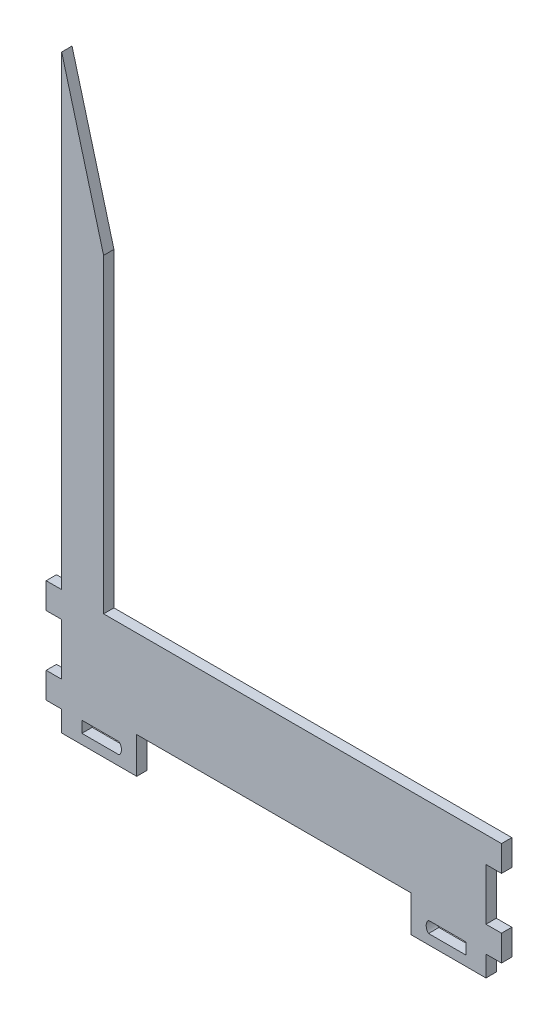
from build123d import *

# Parameters (mm, degrees)
EXTRUDE_1_DEPTH = 2


with BuildPart() as part:
    # 草图3 → 凸台-拉伸1 (new body)
    with BuildSketch(Plane.XY):
        Polygon((41, 20.009783315), (-32.9, 20.009783315), (-32.9, 80.009783315), (-41, 110.001113679), (-41, 60.009783315), (-41, 20.009783315), (-44, 20.009783315), (-44, 15.009783315), (-41, 15.009783315), (-41, 10.009783315), (-41, 7.009783315), (-41, 5.009783315), (-44, 5.009783315), (-44, 0.009783315), (-41, 0.009783315), (-41, -3.990216685), (-26.5, -3.990216685), (-26.5, 3.009783315), (26.5, 3.009783315), (26.5, -3.990216685), (41, -3.990216685), (41, 0.009783315), (44, 0.009783315), (44, 5.009783315), (41, 5.009783315), (41, 7.009783315), (41, 10.009783315), (41, 15.009783315), (44, 15.009783315), (44, 20.009783315), align=None)
        with BuildLine():
            Line((-37.1, -2.090216685), (-29.9, -2.090216685))
            ThreePointArc((-29.9, -2.090216685), (-29.444365081, -0.990216685), (-29.9, 0.109783315))
            Line((-29.9, 0.109783315), (-37.1, 0.109783315))
            Line((-37.1, 0.109783315), (-37.1, -2.090216685))
        make_face(mode=Mode.SUBTRACT)
        with BuildLine():
            Line((37.1, -2.090216685), (29.9, -2.090216685))
            ThreePointArc((29.9, -2.090216685), (29.444365081, -0.990216685), (29.9, 0.109783315))
            Line((29.9, 0.109783315), (37.1, 0.109783315))
            Line((37.1, 0.109783315), (37.1, -2.090216685))
        make_face(mode=Mode.SUBTRACT)
    extrude(amount=EXTRUDE_1_DEPTH)


solid = part.part
